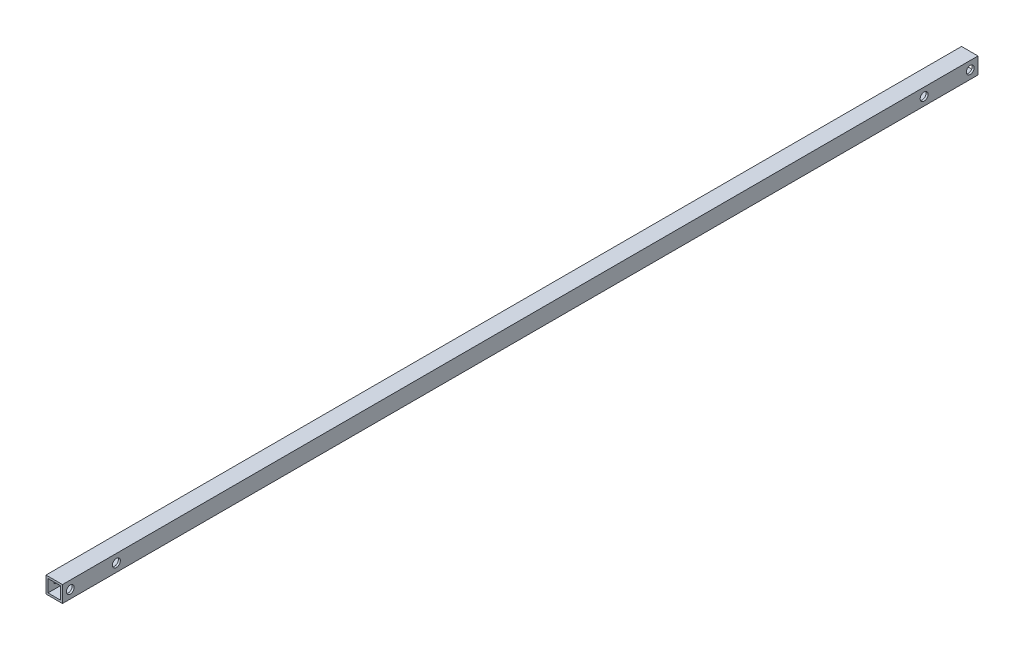
from build123d import *

# Parameters (mm, degrees)
SKETCH_1_W                     = 25
SKETCH_1_H                     = 25
SKETCH_1_W_2                   = 19
SKETCH_1_H_2                   = 19
EXTRUDE_1_DEPTH                = 1390
HOLE_WIZARD_6_0_6_1_AT_2_COUNT = 2
HOLE_WIZARD_6_0_6_1_AT_2_PITCH = 70
CUT_EXTRUDE_1_REACH            = 1392.45
SKETCH_6_R                     = 6
PATTERN_LINEAR_1_COUNT         = 2
PATTERN_LINEAR_1_PITCH         = 1296.34


with BuildPart() as part:
    # 草图1 → 拉伸1 (new body)
    with BuildSketch(Plane.XY):
        with Locations((12.5, -12.5)):
            Rectangle(SKETCH_1_W, SKETCH_1_H)
        with Locations((12.5, -12.5)):
            Rectangle(SKETCH_1_W_2, SKETCH_1_H_2, mode=Mode.SUBTRACT)
    extrude(amount=EXTRUDE_1_DEPTH)

    # 草图4 → Ø6.0 (6) 直径孔1 (revolve, cut)
    with BuildSketch(Plane(origin=(0, -12.5, 11.8), x_dir=(0, 0, 1), z_dir=(0, 1, 0))):
        Polygon((0, 0), (0, 31.802581857), (3, 30), (3, 0), align=None)
    hole_wizard_6_0_6_1 = revolve(axis=Axis((-6.35, -12.5, 11.8), (1, 0, 0)), mode=Mode.SUBTRACT)

    # Ø6.0 (6) 直径孔1 at 2: Ø6.0 (6) 直径孔1 ×2
    with Locations(*[(0, 0, i * HOLE_WIZARD_6_0_6_1_AT_2_PITCH) for i in range(1, HOLE_WIZARD_6_0_6_1_AT_2_COUNT)]):
        add(hole_wizard_6_0_6_1, mode=Mode.SUBTRACT)

    # 草图6 → 切除-拉伸1 (cut, up to next)
    with BuildSketch(Plane(origin=(25, 0, 0), x_dir=(0, 0, -1), z_dir=(1, 0, 0)), mode=Mode.PRIVATE) as cut_extrude_1_sk1:
        with Locations(Location((-11.8, -12.5, 0), (0, 0, 90))):
            Circle(SKETCH_6_R)
    cut_extrude_1_tool1 = extrude(cut_extrude_1_sk1.sketch, amount=-CUT_EXTRUDE_1_REACH, mode=Mode.PRIVATE) & part.part
    # 草图6 → 切除-拉伸1 (cut, up to next)
    with BuildSketch(Plane(origin=(25, 0, 0), x_dir=(0, 0, -1), z_dir=(1, 0, 0)), mode=Mode.PRIVATE) as cut_extrude_1_sk2:
        with Locations(Location((-81.8, -12.5, 0), (0, 0, 90))):
            Circle(SKETCH_6_R)
    cut_extrude_1_tool2 = extrude(cut_extrude_1_sk2.sketch, amount=-CUT_EXTRUDE_1_REACH, mode=Mode.PRIVATE) & part.part
    cut_extrude_1_1 = cut_extrude_1_tool1.solids().sort_by_distance((25, -12.5, 11.8))[0]
    add(cut_extrude_1_1, mode=Mode.SUBTRACT)
    cut_extrude_1_2 = cut_extrude_1_tool2.solids().sort_by_distance((25, -12.5, 81.8))[0]
    add(cut_extrude_1_2, mode=Mode.SUBTRACT)
    cut_extrude_1 = cut_extrude_1_1 + cut_extrude_1_2  # 切除-拉伸1 as one shape, for the pattern or mirror that repeats it

    # 阵列(线性)1: Ø6.0 (6) 直径孔1, 切除-拉伸1 ×2
    with Locations(*[(0, 0, i * PATTERN_LINEAR_1_PITCH) for i in range(1, PATTERN_LINEAR_1_COUNT)]):
        add(hole_wizard_6_0_6_1, mode=Mode.SUBTRACT)
        add(cut_extrude_1, mode=Mode.SUBTRACT)

    # 阵列(线性)1 copy 1 sketch → 阵列(线性)1 copy 1 (revolve, cut)
    with BuildSketch(Plane(origin=(0, -12.5, 1378.14), x_dir=(0, 0, 1), z_dir=(0, 1, 0))):
        Polygon((0, 0), (0, 31.802581857), (3, 30), (3, 0), align=None)
    revolve(axis=Axis((-6.35, -12.5, 1378.14), (1, 0, 0)), mode=Mode.SUBTRACT)


solid = part.part
